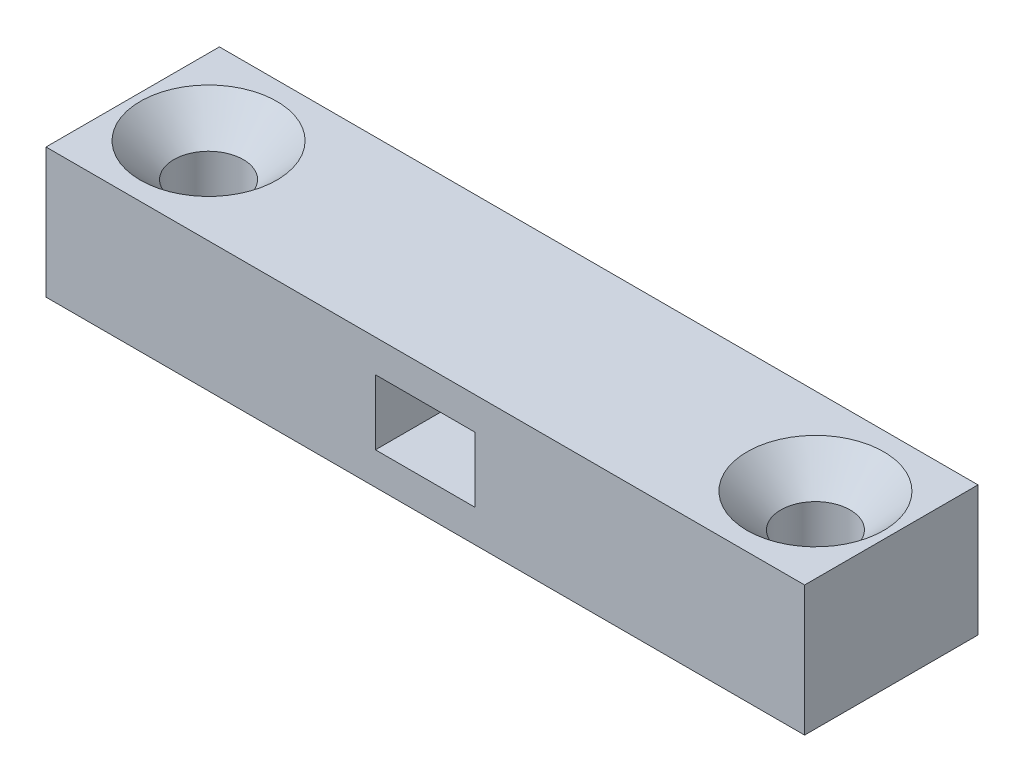
from build123d import *

# Parameters (mm, degrees)
SKETCH1_W                                       = 35
SKETCH1_H                                       = 8
BOSS_EXTRUDE1_DEPTH                             = 6
SKETCH2_W                                       = 4.6
SKETCH2_H                                       = 3
CUT_EXTRUDE1_DEPTH                              = 5
CSK_FOR_M3_FLAT_HEAD_MACHINE_SCREW1_D           = 3.2
CSK_FOR_M3_FLAT_HEAD_MACHINE_SCREW1_CSINK_D     = 6.3
CSK_FOR_M3_FLAT_HEAD_MACHINE_SCREW1_CSINK_ANGLE = 90


with BuildPart() as part:
    # Sketch1 → Boss-Extrude1 (new body)
    with BuildSketch(Plane(origin=(0, 0, 0), x_dir=(1, 0, 0), z_dir=(0, 1, 0))):
        Rectangle(SKETCH1_W, SKETCH1_H)
    extrude(amount=-BOSS_EXTRUDE1_DEPTH)

    # Sketch2 → Cut-Extrude1 (cut)
    with BuildSketch(Plane.XY.offset(4)):
        with Locations((0, -3)):
            Rectangle(SKETCH2_W, SKETCH2_H)
    extrude(amount=-CUT_EXTRUDE1_DEPTH, mode=Mode.SUBTRACT)

    # CSK for M3 Flat Head Machine Screw1 (through all)
    with Locations(Plane(origin=(-14, 0, 0), x_dir=(0, 0, 1), z_dir=(0, 1, 0))):
        with Locations((0, 0), (0, 28)):
            CounterSinkHole(CSK_FOR_M3_FLAT_HEAD_MACHINE_SCREW1_D / 2, CSK_FOR_M3_FLAT_HEAD_MACHINE_SCREW1_CSINK_D / 2, counter_sink_angle=CSK_FOR_M3_FLAT_HEAD_MACHINE_SCREW1_CSINK_ANGLE)


solid = part.part
